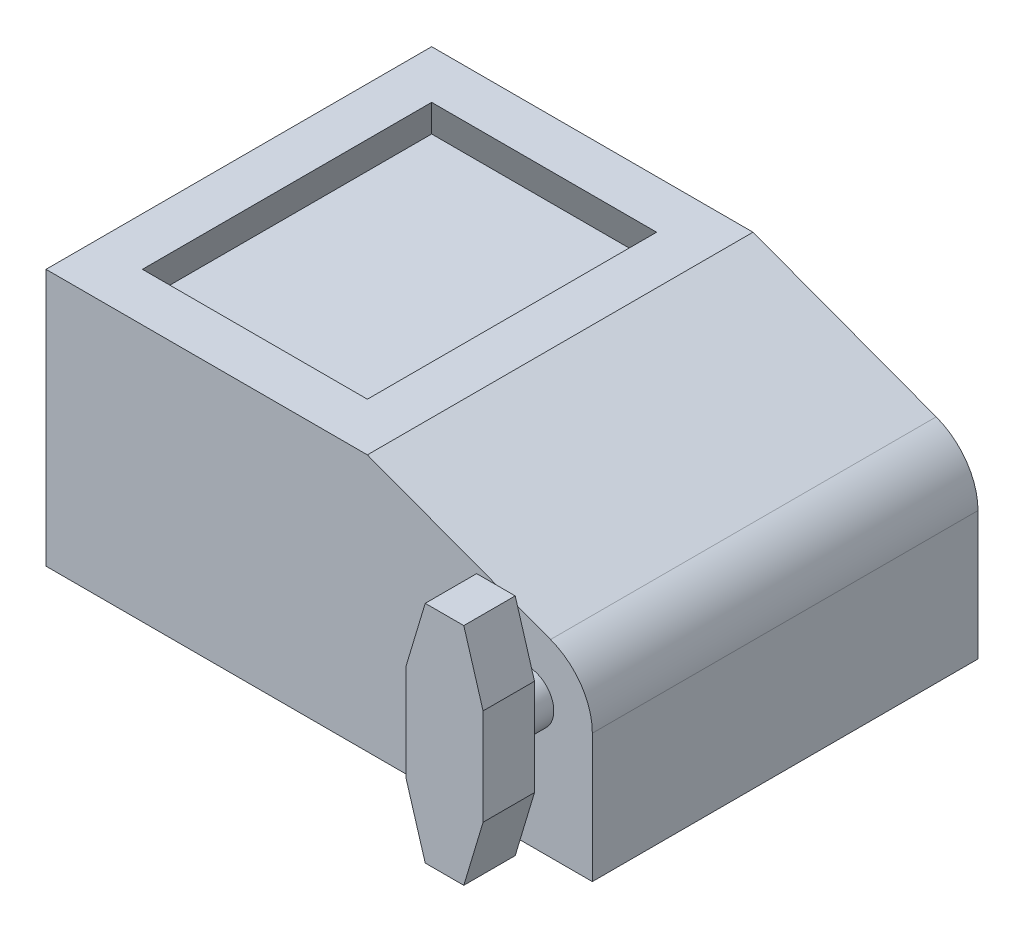
from build123d import *
from OCP.BRepFilletAPI import BRepFilletAPI_MakeChamfer

# Parameters (mm, degrees)
SKETCH1_W           = 50
SKETCH1_H           = 60
BOSS_EXTRUDE1_DEPTH = 40
BOSS_EXTRUDE2_DEPTH = 60
SKETCH3_W           = 35
SKETCH3_H           = 45
CUT_EXTRUDE1_DEPTH  = 8
CUT_EXTRUDE1_DRAFT  = 25
SKETCH4_R           = 4
BOSS_EXTRUDE3_DEPTH = 5
SKETCH5_W           = 12
SKETCH5_H           = 35
BOSS_EXTRUDE4_DEPTH = 8
CHAMFER1_SIZE       = 3
CHAMFER1_SIZE2      = 10
CHAMFER2_SIZE       = 10
CHAMFER2_SIZE2      = 3


with BuildPart() as part:
    # Sketch1 → Boss-Extrude1 (new body)
    with BuildSketch(Plane(origin=(0, 0, 0), x_dir=(1, 0, 0), z_dir=(0, 1, 0))):
        Rectangle(SKETCH1_W, SKETCH1_H)
    extrude(amount=BOSS_EXTRUDE1_DEPTH)

    # Sketch2 → Boss-Extrude2 (add)
    with BuildSketch(Plane.XY.offset(30)):
        with BuildLine():
            Line((53.495378078, 29.369222598), (25, 40))
            Line((25, 40), (25, 0))
            Line((25, 0), (60, 0))
            Line((60, 0), (60, 20))
            ThreePointArc((60, 20), (58.214431836, 25.702903612), (53.495378078, 29.369222598))
        make_face()
    extrude(amount=-BOSS_EXTRUDE2_DEPTH)


with BuildPart() as cut_extrude1_tool:
    # Sketch3 → Cut-Extrude1 (with draft: the straight prism first)
    with BuildSketch(Plane(origin=(0, 40, 0), x_dir=(1, 0, 0), z_dir=(0, 1, 0))):
        Rectangle(SKETCH3_W, SKETCH3_H)
    extrude(amount=-CUT_EXTRUDE1_DEPTH)
    # Cut-Extrude1: the draft: its side faces are tilted about the plane it starts from
    cut_extrude1_sides = [cut_extrude1_tool.faces().sort_by_distance(p)[0] for p in [
        (0, 36, 22.5),
        (17.5, 36, 0),
        (0, 36, -22.5),
        (-17.5, 36, 0),
    ]]
    draft(cut_extrude1_sides, Plane(origin=(0, 40, 0), x_dir=(1, 0, 0), z_dir=(0, 1, 0)), CUT_EXTRUDE1_DRAFT)


with BuildPart() as part_1:
    add(part.part)

    # Cut-Extrude1: cut by cut_extrude1_tool
    add(cut_extrude1_tool.part, mode=Mode.SUBTRACT)

    # Sketch4 → Boss-Extrude3 (add)
    with BuildSketch(Plane.XY.offset(30)):
        with Locations(Location((50, 20, 0), (0, 0, 180))):
            Circle(SKETCH4_R)
    extrude(amount=BOSS_EXTRUDE3_DEPTH)

    # Sketch5 → Boss-Extrude4 (add)
    with BuildSketch(Plane.XY.offset(35)):
        with Locations((50, 20)):
            Rectangle(SKETCH5_W, SKETCH5_H)
    extrude(amount=BOSS_EXTRUDE4_DEPTH)

    # Chamfer1: one chamfer whose edges measure the first distance from different faces: ONE call of the kernel's chamfer builder (chamfer() names one face for all edges)
    chamfer1_edges_1 = [part_1.edges().sort_by_distance(p)[0] for p in [
        (56, 2.5, 39),
    ]]
    chamfer1_side_1 = [part_1.faces().sort_by_distance(p)[0] for p in [
        (50, 2.5, 39),
    ]]
    chamfer1_edges_2 = [part_1.edges().sort_by_distance(p)[0] for p in [
        (44, 37.5, 39),
    ]]
    chamfer1_side_2 = [part_1.faces().sort_by_distance(p)[0] for p in [
        (50, 37.5, 39),
    ]]
    chamfer1 = BRepFilletAPI_MakeChamfer(part_1.part.solid().wrapped)
    for e in chamfer1_edges_1:
        chamfer1.Add(CHAMFER1_SIZE, CHAMFER1_SIZE2, e.wrapped, chamfer1_side_1[0].wrapped)  # the first distance lies on this face
    for e in chamfer1_edges_2:
        chamfer1.Add(CHAMFER1_SIZE, CHAMFER1_SIZE2, e.wrapped, chamfer1_side_2[0].wrapped)  # the first distance lies on this face
    add(Compound.cast(chamfer1.Shape()), mode=Mode.REPLACE)

    # Chamfer2: one chamfer whose edges measure the first distance from different faces: ONE call of the kernel's chamfer builder (chamfer() names one face for all edges)
    chamfer2_edges_1 = [part_1.edges().sort_by_distance(p)[0] for p in [
        (56, 37.5, 39),
    ]]
    chamfer2_side_1 = [part_1.faces().sort_by_distance(p)[0] for p in [
        (56, 25, 39),
    ]]
    chamfer2_edges_2 = [part_1.edges().sort_by_distance(p)[0] for p in [
        (44, 2.5, 39),
    ]]
    chamfer2_side_2 = [part_1.faces().sort_by_distance(p)[0] for p in [
        (44, 15, 39),
    ]]
    chamfer2 = BRepFilletAPI_MakeChamfer(part_1.part.solid().wrapped)
    for e in chamfer2_edges_1:
        chamfer2.Add(CHAMFER2_SIZE, CHAMFER2_SIZE2, e.wrapped, chamfer2_side_1[0].wrapped)  # the first distance lies on this face
    for e in chamfer2_edges_2:
        chamfer2.Add(CHAMFER2_SIZE, CHAMFER2_SIZE2, e.wrapped, chamfer2_side_2[0].wrapped)  # the first distance lies on this face
    add(Compound.cast(chamfer2.Shape()), mode=Mode.REPLACE)


solid = part_1.part
